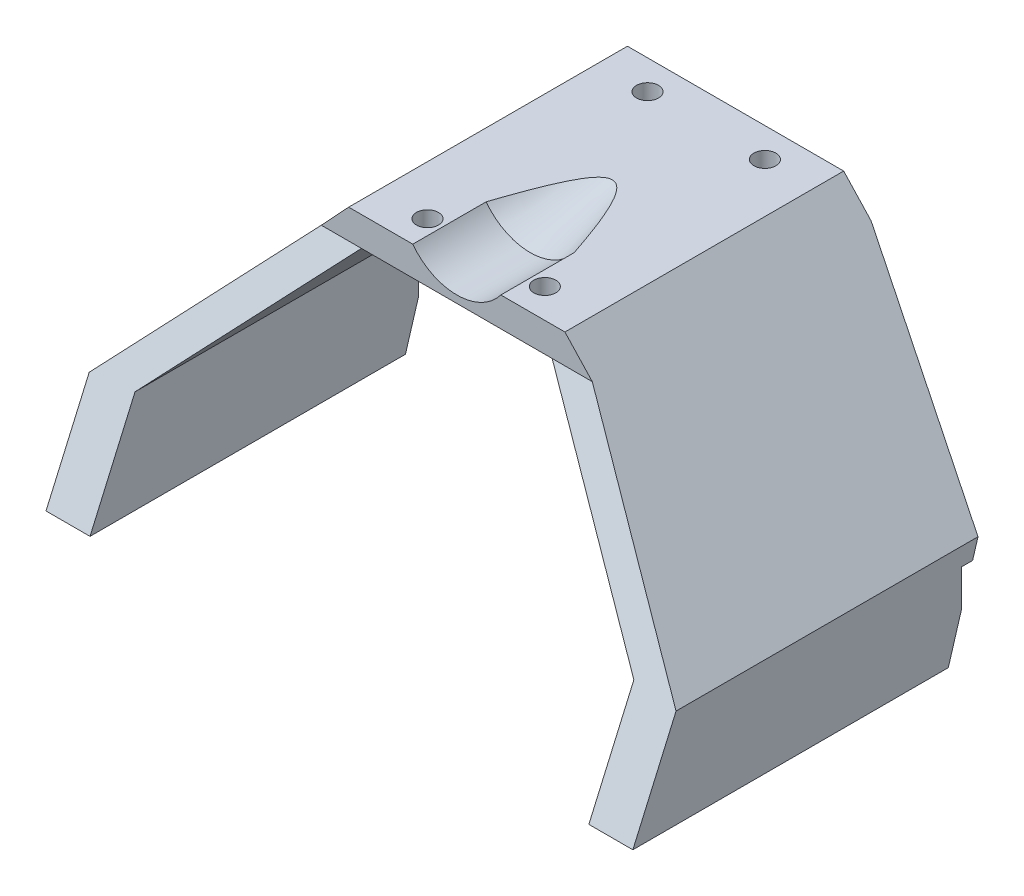
from build123d import *

# Parameters (mm, degrees)
BOSS_EXTRUDE1_DEPTH       = 54
CUT_EXTRUDE1_DEPTH        = 79.461774132
CUT_EXTRUDE1_DEPTH_BACK   = 79.461774132
F_3_0MM_DOWEL_HOLE1_D     = 3
F_3_0MM_DOWEL_HOLE2_D     = 2.9
F_3_0MM_DOWEL_HOLE2_DEPTH = 10
F_3_0MM_DOWEL_HOLE2_TIP   = 0.871247898
SKETCH8_W                 = 2.769274519
SKETCH8_H                 = 5
CUT_EXTRUDE2_DEPTH        = 105.672107077
SKETCH10_R                = 7.5
CUT_EXTRUDE3_DEPTH        = 10
SKETCH11_R                = 7.5
CUT_EXTRUDE4_DEPTH        = 15
CUT_EXTRUDE4_DRAFT        = -15


with BuildPart() as part:
    # Sketch1 → Boss-Extrude1 (new body)
    with BuildSketch(Plane.XY):
        Polygon((14.738209208, 40.5), (-14.738209208, 40.5), (-40, 13.43379558), (-40, 0), (-34, 0), (-34, 14), (-13, 36.5), (13, 36.5), (34, 14), (34, 0), (40, 0), (40, 13.43379558), align=None)
    extrude(amount=BOSS_EXTRUDE1_DEPTH)

    # Sketch2 → Cut-Extrude1 (cut, two sides: drawn at the far end of the back side and taken through both)
    with BuildSketch(Plane(origin=(0, 0, 0), x_dir=(0, 0, -1), z_dir=(1, 0, 0)).offset(-CUT_EXTRUDE1_DEPTH_BACK)):
        Polygon((0, 36.5), (-11, 0), (0, 0), align=None)
        Polygon((-38, 40.5), (-38, 36.5), (-54, 0), (-54, 40.5), align=None)
    extrude(amount=CUT_EXTRUDE1_DEPTH + CUT_EXTRUDE1_DEPTH_BACK, mode=Mode.SUBTRACT)

    # Ø3.0mm Dowel Hole1 (through all)
    with Locations(Plane(origin=(-8, 40.5, 4), x_dir=(0, 0, 1), z_dir=(0, 1, 0))):
        with Locations((0, 0), (0, 16), (30, 16), (30, 0)):
            Hole(F_3_0MM_DOWEL_HOLE1_D / 2)

    # Ø3.0mm Dowel Hole2
    with Locations(Plane(origin=(-37, 0, 48), x_dir=(0, 0, -1), z_dir=(0, -1, 0))):
        with Locations((0, 0), (0, 74), (31, 74), (31, 0)):
            Hole(F_3_0MM_DOWEL_HOLE2_D / 2, depth=F_3_0MM_DOWEL_HOLE2_DEPTH)
            with Locations((0, 0, -(F_3_0MM_DOWEL_HOLE2_DEPTH + F_3_0MM_DOWEL_HOLE2_TIP / 2))):  # 118° drill point
                Cone(0, F_3_0MM_DOWEL_HOLE2_D / 2, F_3_0MM_DOWEL_HOLE2_TIP, mode=Mode.SUBTRACT)

    # Sketch8 → Cut-Extrude2 (cut, through all)
    with BuildSketch(Plane.ZY.offset(40)):
        with Locations((7.807143563, 8.5)):
            Rectangle(SKETCH8_W, SKETCH8_H)
    extrude(amount=-CUT_EXTRUDE2_DEPTH, mode=Mode.SUBTRACT)

    # Sketch10 → Cut-Extrude3 (cut)
    with BuildSketch(Plane.XY.offset(38)):
        with Locations((0, 45)):
            Circle(SKETCH10_R)
    extrude(amount=-CUT_EXTRUDE3_DEPTH, mode=Mode.SUBTRACT)


with BuildPart() as cut_extrude4_tool:
    # Sketch11 → Cut-Extrude4 (with draft: the straight prism first)
    with BuildSketch(Plane.XY.offset(28)):
        with Locations((0, 45)):
            Circle(SKETCH11_R)
    extrude(amount=-CUT_EXTRUDE4_DEPTH)
    # Cut-Extrude4: the draft: its side faces are tilted about the plane it starts from
    cut_extrude4_sides = [cut_extrude4_tool.faces().sort_by_distance(p)[0] for p in [
        (-7.5, 45, 20.5),
    ]]
    draft(cut_extrude4_sides, Plane.XY.offset(28), CUT_EXTRUDE4_DRAFT)


with BuildPart() as part_1:
    add(part.part)

    # Cut-Extrude4: cut by cut_extrude4_tool
    add(cut_extrude4_tool.part, mode=Mode.SUBTRACT)


solid = part_1.part
